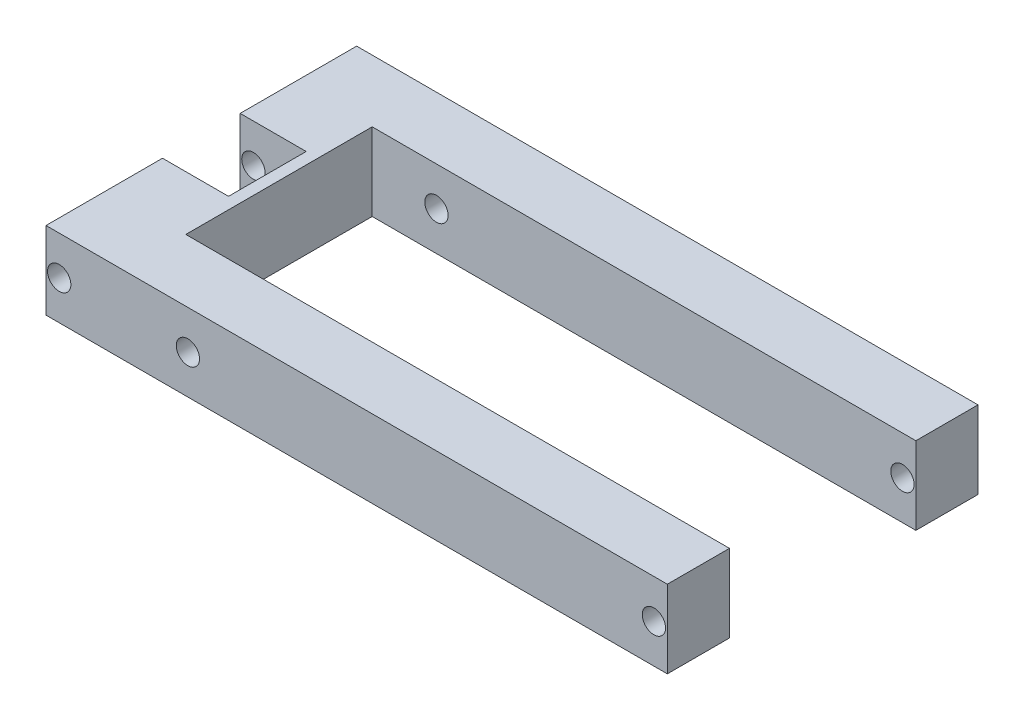
from build123d import *

# Parameters (mm, degrees)
ESTRUSIONE_ESTRUSIONE1_DEPTH  = 100
TAGLIO_ESTRUSIONE5_DEPTH      = 518.911277836
TAGLIO_ESTRUSIONE5_DEPTH_BACK = 518.911277836
SCHIZZO2_R                    = 15
TAGLIO_ESTRUSIONE6_DEPTH      = 518.911277836
TAGLIO_ESTRUSIONE6_DEPTH_BACK = 518.911277836
SCHIZZO3_W                    = 85
SCHIZZO3_H                    = 100


with BuildPart() as part:
    # Schizzo1 → Estrusione-Estrusione1 (new body)
    with BuildSketch(Plane(origin=(0, 0, 0), x_dir=(1, 0, 0), z_dir=(0, 1, 0))):
        Polygon((-332.846822006, -200), (-332.846822006, 200), (467.153177994, 200), (467.153177994, 120), (-232.846822006, 120), (-232.846822006, -120), (467.153177994, -120), (467.153177994, -200), align=None)
    extrude(amount=ESTRUSIONE_ESTRUSIONE1_DEPTH)

    # Schizzo2 → Taglio-Estrusione5 (cut, two sides: drawn at the far end of the back side and taken through both)
    with BuildSketch(Plane.XY.offset(-TAGLIO_ESTRUSIONE5_DEPTH_BACK)):
        with Locations((-315.846822006, 50)):
            Circle(SCHIZZO2_R)
        with Locations((-150.146822006, 50)):
            Circle(SCHIZZO2_R)
        with Locations((449.853177994, 50)):
            Circle(SCHIZZO2_R)
    extrude(amount=TAGLIO_ESTRUSIONE5_DEPTH + TAGLIO_ESTRUSIONE5_DEPTH_BACK, mode=Mode.SUBTRACT)

    # Schizzo3 → Taglio-Estrusione6 (cut, two sides: drawn at the far end of the back side and taken through both)
    with BuildSketch(Plane(origin=(0, 0, 0), x_dir=(1, 0, 0), z_dir=(0, 1, 0)).offset(-TAGLIO_ESTRUSIONE6_DEPTH_BACK)):
        with Locations((-290.346822006, 0)):
            Rectangle(SCHIZZO3_W, SCHIZZO3_H)
    extrude(amount=TAGLIO_ESTRUSIONE6_DEPTH + TAGLIO_ESTRUSIONE6_DEPTH_BACK, mode=Mode.SUBTRACT)


solid = part.part
